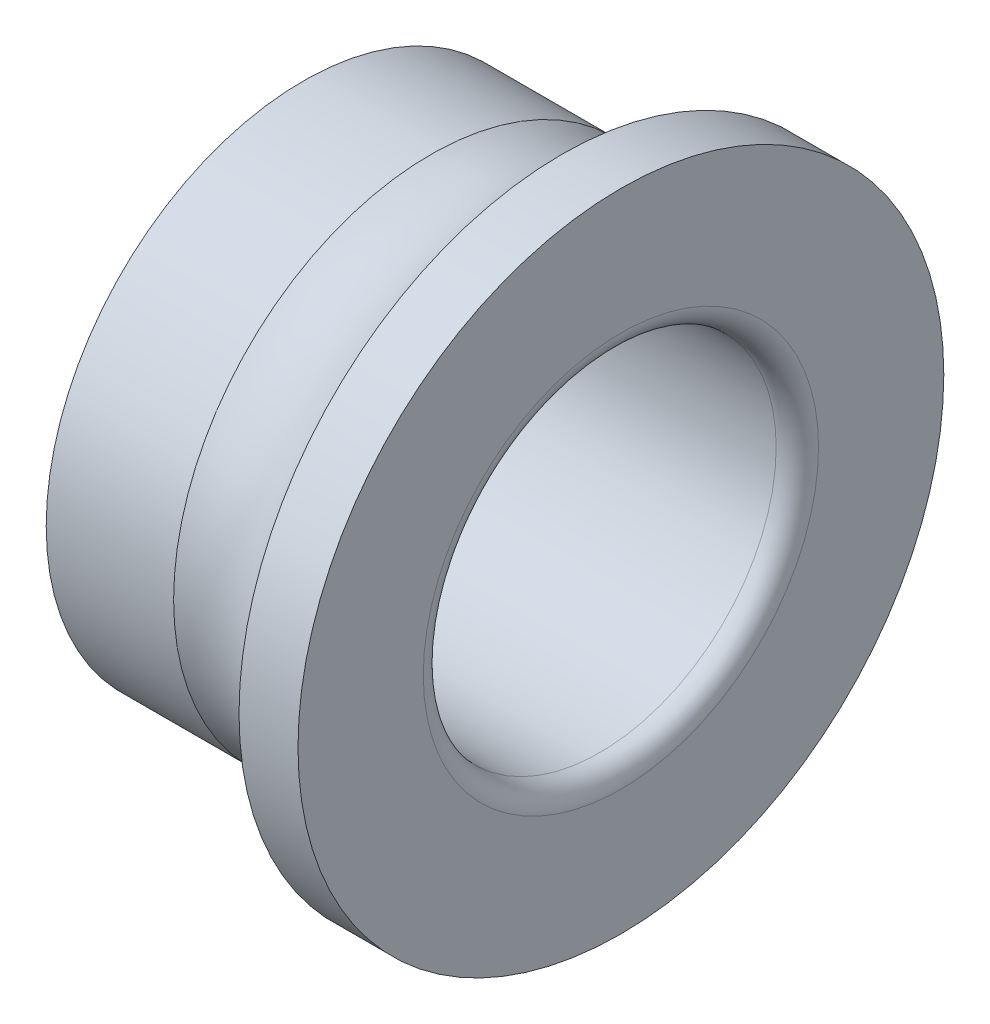
from build123d import *


with BuildPart() as part:
    # Sketch1 → Revolve1 (revolve)
    with BuildSketch(Plane.XY, mode=Mode.PRIVATE) as revolve1_sk:
        with BuildLine():
            Line((0, 7.285), (0, 5.6))
            ThreePointArc((0, 5.6), (0.175735931, 5.175735931), (0.6, 5))
            Line((0.6, 5), (8.4, 5))
            ThreePointArc((8.4, 5), (8.824264069, 5.175735931), (9, 5.6))
            Line((9, 5.6), (9, 9.15))
            Line((9, 9.15), (7.328427125, 9.15))
            ThreePointArc((7.328427125, 9.15), (5.845030918, 7.468416171), (3.610182603, 7.285))
            Line((3.610182603, 7.285), (0, 7.285))
        make_face()
    revolve(revolve1_sk.sketch.rotate(Axis((9, 0, 0), (-1, 0, 0)), 270), axis=Axis((9, 0, 0), (-1, 0, 0)))


solid = part.part
